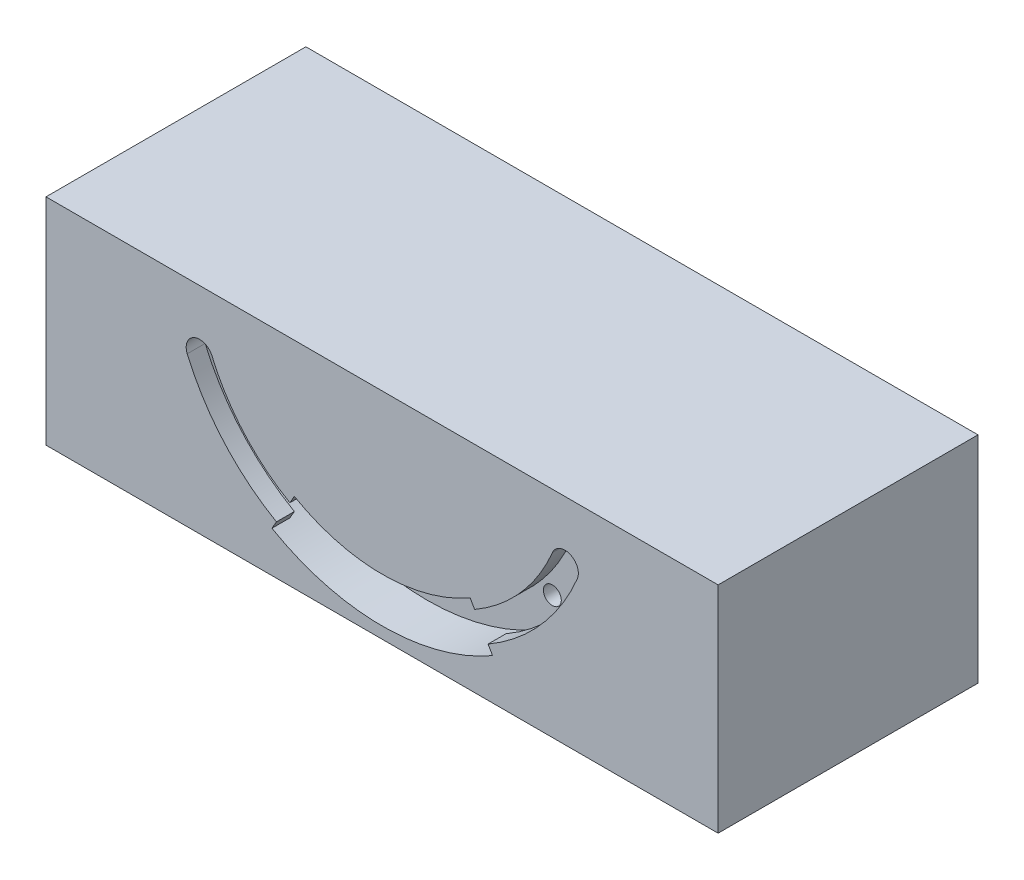
from build123d import *

# Parameters (mm, degrees)
BOSS_EXTRUDE1_DEPTH      = 24
BOSS_EXTRUDE1_DEPTH_BACK = 3
SKETCH1_W                = 75
SKETCH1_H                = 24
CUT_EXTRUDE1_START       = -5
SKETCH2_W                = 30
SKETCH2_H                = 20
CUT_EXTRUDE1_DEPTH       = 20
CUT_EXTRUDE2_DEPTH       = 3
CUT_EXTRUDE3_REACH       = 63.438
SKETCH20_R               = 1
CUT_EXTRUDE4_REACH       = 63.438
SKETCH21_R               = 1.5
SKETCH24_W               = 75
SKETCH24_H               = 24
BOSS_EXTRUDE2_DEPTH      = 2
CUT_EXTRUDE5_DEPTH       = 5


with BuildPart() as part:
    # Sketch1 → Boss-Extrude1 (new, two sides: drawn at the far end of the back side and taken through both)
    with BuildSketch(Plane.XY.offset(-BOSS_EXTRUDE1_DEPTH_BACK)):
        with Locations((13.875, 8.15625)):
            Rectangle(SKETCH1_W, SKETCH1_H)
    extrude(amount=BOSS_EXTRUDE1_DEPTH + BOSS_EXTRUDE1_DEPTH_BACK)

    # Sketch2 → Cut-Extrude1 (cut)
    with BuildSketch(Plane.XY.offset(24).offset(CUT_EXTRUDE1_START)):
        with Locations((-3.625, 8.15625)):
            Rectangle(SKETCH2_W, SKETCH2_H)
        with Locations((31.375, 8.15625)):
            Rectangle(SKETCH2_W, SKETCH2_H)
    extrude(amount=-CUT_EXTRUDE1_DEPTH, mode=Mode.SUBTRACT)

    # Sketch3 → Cut-Extrude2 (cut)
    with BuildSketch(Plane.XY.offset(24)):
        with BuildLine():
            ThreePointArc((-8.784211185, 12.48145261), (13.902958167, -2.563657938), (36.582455444, 12.493015262))
            ThreePointArc((36.582455444, 12.493015262), (35.249734837, 15.767745141), (31.975004957, 14.435024533))
            ThreePointArc((31.975004957, 14.435024533), (13.901683811, 2.436341899), (-4.177751221, 14.425810242))
            ThreePointArc((-4.177751221, 14.425810242), (-7.453160019, 15.756861408), (-8.784211185, 12.48145261))
        make_face()
    extrude(amount=-CUT_EXTRUDE2_DEPTH, mode=Mode.SUBTRACT)

    # Sketch20 → Cut-Extrude3 (cut, up to next)
    with BuildSketch(Plane.XY.offset(24), mode=Mode.PRIVATE) as cut_extrude3_sk1:
        with Locations((27.875, 4.90625)):
            Circle(SKETCH20_R)
    cut_extrude3_tool1 = extrude(cut_extrude3_sk1.sketch, amount=-CUT_EXTRUDE3_REACH, mode=Mode.PRIVATE) & part.part
    # Sketch20 → Cut-Extrude3 (cut, up to next)
    with BuildSketch(Plane.XY.offset(24), mode=Mode.PRIVATE) as cut_extrude3_sk2:
        with Locations((-0.125, 4.90625)):
            Circle(SKETCH20_R)
    cut_extrude3_tool2 = extrude(cut_extrude3_sk2.sketch, amount=-CUT_EXTRUDE3_REACH, mode=Mode.PRIVATE) & part.part
    add(cut_extrude3_tool1.solids().sort_by_distance((27.875, 4.90625, 24))[0], mode=Mode.SUBTRACT)
    add(cut_extrude3_tool2.solids().sort_by_distance((-0.125, 4.90625, 24))[0], mode=Mode.SUBTRACT)

    # Sketch21 → Cut-Extrude4 (cut, up to next)
    with BuildSketch(Plane(origin=(0, 0, -3), x_dir=(-1, 0, 0), z_dir=(0, 0, -1)), mode=Mode.PRIVATE) as cut_extrude4_sk1:
        with Locations((-32.680205402, 5.075855595)):
            Circle(SKETCH21_R)
    cut_extrude4_tool1 = extrude(cut_extrude4_sk1.sketch, amount=-CUT_EXTRUDE4_REACH, mode=Mode.PRIVATE) & part.part
    # Sketch21 → Cut-Extrude4 (cut, up to next)
    with BuildSketch(Plane(origin=(0, 0, -3), x_dir=(-1, 0, 0), z_dir=(0, 0, -1)), mode=Mode.PRIVATE) as cut_extrude4_sk2:
        with Locations((-27.861682335, 5.087799818)):
            Circle(SKETCH21_R)
    cut_extrude4_tool2 = extrude(cut_extrude4_sk2.sketch, amount=-CUT_EXTRUDE4_REACH, mode=Mode.PRIVATE) & part.part
    # Sketch21 → Cut-Extrude4 (cut, up to next)
    with BuildSketch(Plane(origin=(0, 0, -3), x_dir=(-1, 0, 0), z_dir=(0, 0, -1)), mode=Mode.PRIVATE) as cut_extrude4_sk3:
        with Locations(Location((0.111682335, 5.087799818, 0), (0, 0, 180))):
            Circle(SKETCH21_R)
    cut_extrude4_tool3 = extrude(cut_extrude4_sk3.sketch, amount=-CUT_EXTRUDE4_REACH, mode=Mode.PRIVATE) & part.part
    # Sketch21 → Cut-Extrude4 (cut, up to next)
    with BuildSketch(Plane(origin=(0, 0, -3), x_dir=(-1, 0, 0), z_dir=(0, 0, -1)), mode=Mode.PRIVATE) as cut_extrude4_sk4:
        with Locations(Location((4.930205402, 5.075855595, 0), (0, 0, 180))):
            Circle(SKETCH21_R)
    cut_extrude4_tool4 = extrude(cut_extrude4_sk4.sketch, amount=-CUT_EXTRUDE4_REACH, mode=Mode.PRIVATE) & part.part
    add(cut_extrude4_tool1.solids().sort_by_distance((32.680205, 5.075856, -3))[0], mode=Mode.SUBTRACT)
    add(cut_extrude4_tool2.solids().sort_by_distance((27.861682, 5.0878, -3))[0], mode=Mode.SUBTRACT)
    add(cut_extrude4_tool3.solids().sort_by_distance((-0.111682, 5.0878, -3))[0], mode=Mode.SUBTRACT)
    add(cut_extrude4_tool4.solids().sort_by_distance((-4.930205, 5.075856, -3))[0], mode=Mode.SUBTRACT)

    # Sketch24 → Boss-Extrude2 (add)
    with BuildSketch(Plane.XY.offset(24)):
        with Locations((13.875, 8.15625)):
            Rectangle(SKETCH24_W, SKETCH24_H)
        with BuildLine():
            ThreePointArc((-7.862919192, 12.870324137), (13.902703295, -1.563657971), (35.660965347, 12.881417116))
            ThreePointArc((35.660965347, 12.881417116), (34.861332982, 14.846255044), (32.896495055, 14.046622679))
            ThreePointArc((32.896495055, 14.046622679), (13.901938682, 1.436341932), (-5.099043214, 14.036938715))
            ThreePointArc((-5.099043214, 14.036938715), (-7.064288492, 14.835569415), (-7.862919192, 12.870324137))
        make_face(mode=Mode.SUBTRACT)
    extrude(amount=BOSS_EXTRUDE2_DEPTH)

    # Sketch26 → Cut-Extrude5 (cut)
    with BuildSketch(Plane.XY.offset(26)):
        with BuildLine():
            Line((23.705970435, 5.064731747), (26.205970435, 0.734604728))
            ThreePointArc((26.205970435, 0.734604728), (13.896683604, -2.563658738), (1.587396774, 0.734604728))
            Line((1.587396774, 0.734604728), (4.087396774, 5.064731747))
            ThreePointArc((4.087396774, 5.064731747), (13.896683604, 2.436341262), (23.705970435, 5.064731747))
        make_face()
    extrude(amount=-CUT_EXTRUDE5_DEPTH, mode=Mode.SUBTRACT)


solid = part.part
